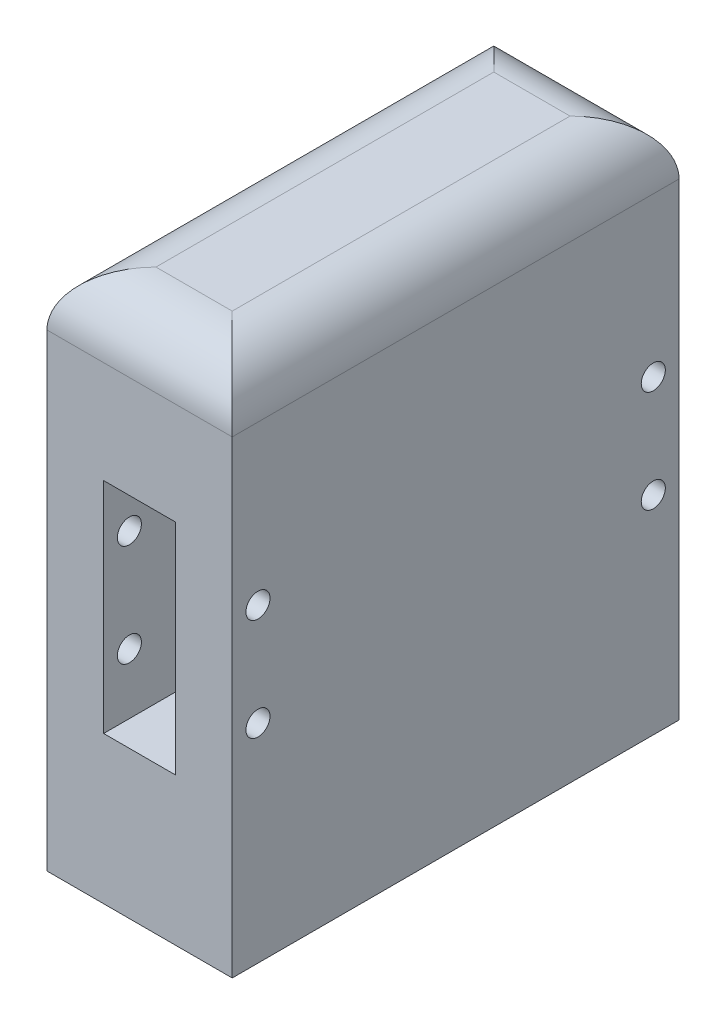
from build123d import *

# Parameters (mm, degrees)
SKETCH1_W                    = 17
SKETCH1_H                    = 41
BOSS_EXTRUDE1_DEPTH          = 48
SKETCH2_W                    = 6.6
SKETCH2_H                    = 20.1
CUT_EXTRUDE1_DEPTH           = 64.696546217
SKETCH3_R                    = 1.105
CUT_EXTRUDE2_DEPTH           = 55.893077888
SKETCH4_R                    = 6.4
CUT_EXTRUDE3_DEPTH           = 42
FILLET3_R                    = 5
SKETCH8_W                    = 8
SKETCH8_H                    = 27.344585772
CUT_EXTRUDE4_DEPTH           = 15
TAP_DRILL_FOR_M3_TAP1_REACH  = 60.588
TAP_DRILL_FOR_M3_TAP1_BORE_R = 1.25


with BuildPart() as part:
    # Sketch1 → Boss-Extrude1 (new body)
    with BuildSketch(Plane(origin=(0, 0, 0), x_dir=(1, 0, 0), z_dir=(0, 1, 0))):
        Rectangle(SKETCH1_W, SKETCH1_H)
    extrude(amount=BOSS_EXTRUDE1_DEPTH)

    # Sketch2 → Cut-Extrude1 (cut, through all)
    with BuildSketch(Plane(origin=(0, 0, -20.5), x_dir=(-1, 0, 0), z_dir=(0, 0, -1))):
        with Locations((0, 23.582414356)):
            Rectangle(SKETCH2_W, SKETCH2_H)
    extrude(amount=-CUT_EXTRUDE1_DEPTH, mode=Mode.SUBTRACT)

    # Sketch3 → Cut-Extrude2 (cut, through all)
    with BuildSketch(Plane(origin=(8.5, 0, 0), x_dir=(0, 0, -1), z_dir=(1, 0, 0))):
        with Locations((-18.138, 19.075341505)):
            Circle(SKETCH3_R)
        with Locations((-18.138, 28.455341505)):
            Circle(SKETCH3_R)
        with Locations((18.138, 28.455341505)):
            Circle(SKETCH3_R)
        with Locations((18.138, 19.075341505)):
            Circle(SKETCH3_R)
    extrude(amount=-CUT_EXTRUDE2_DEPTH, mode=Mode.SUBTRACT)

    # Sketch4 → Cut-Extrude3 (cut)
    with BuildSketch(Plane.XZ):
        with Locations(Location((0, 0, 0), (0, 0, 270))):
            Circle(SKETCH4_R)
    extrude(amount=-CUT_EXTRUDE3_DEPTH, mode=Mode.SUBTRACT)

    # Fillet3
    fillet3_edges = [part.edges().sort_by_distance(p)[0] for p in [
        (-8.5, 48, 0),
        (0, 48, 20.5),
        (8.5, 48, 0),
        (0, 48, -20.5),
    ]]
    fillet(fillet3_edges, radius=FILLET3_R)

    # Sketch8 → Cut-Extrude4 (cut)
    with BuildSketch(Plane.XZ.offset(-42)):
        Rectangle(SKETCH8_W, SKETCH8_H)
    extrude(amount=CUT_EXTRUDE4_DEPTH, mode=Mode.SUBTRACT)

    # Tap Drill for M3 Tap1 bore (on position points) → Tap Drill for M3 Tap1 (cut, up to next)
    with BuildSketch(Plane(origin=(0, 0, -12), x_dir=(0, 0, -1), z_dir=(0, -1, 0)), mode=Mode.PRIVATE) as tap_drill_for_m3_tap1_sk1:
        Circle(TAP_DRILL_FOR_M3_TAP1_BORE_R)
    tap_drill_for_m3_tap1_tool1 = extrude(tap_drill_for_m3_tap1_sk1.sketch, amount=-TAP_DRILL_FOR_M3_TAP1_REACH, mode=Mode.PRIVATE) & part.part
    # Tap Drill for M3 Tap1 bore (on position points) → Tap Drill for M3 Tap1 (cut, up to next)
    with BuildSketch(Plane(origin=(0, 0, -12), x_dir=(0, 0, -1), z_dir=(0, -1, 0)), mode=Mode.PRIVATE) as tap_drill_for_m3_tap1_sk2:
        with Locations((-24, 0)):
            Circle(TAP_DRILL_FOR_M3_TAP1_BORE_R)
    tap_drill_for_m3_tap1_tool2 = extrude(tap_drill_for_m3_tap1_sk2.sketch, amount=-TAP_DRILL_FOR_M3_TAP1_REACH, mode=Mode.PRIVATE) & part.part
    add(tap_drill_for_m3_tap1_tool1.solids().sort_by_distance((0, 0, -12))[0], mode=Mode.SUBTRACT)
    add(tap_drill_for_m3_tap1_tool2.solids().sort_by_distance((0, 0, 12))[0], mode=Mode.SUBTRACT)


solid = part.part
